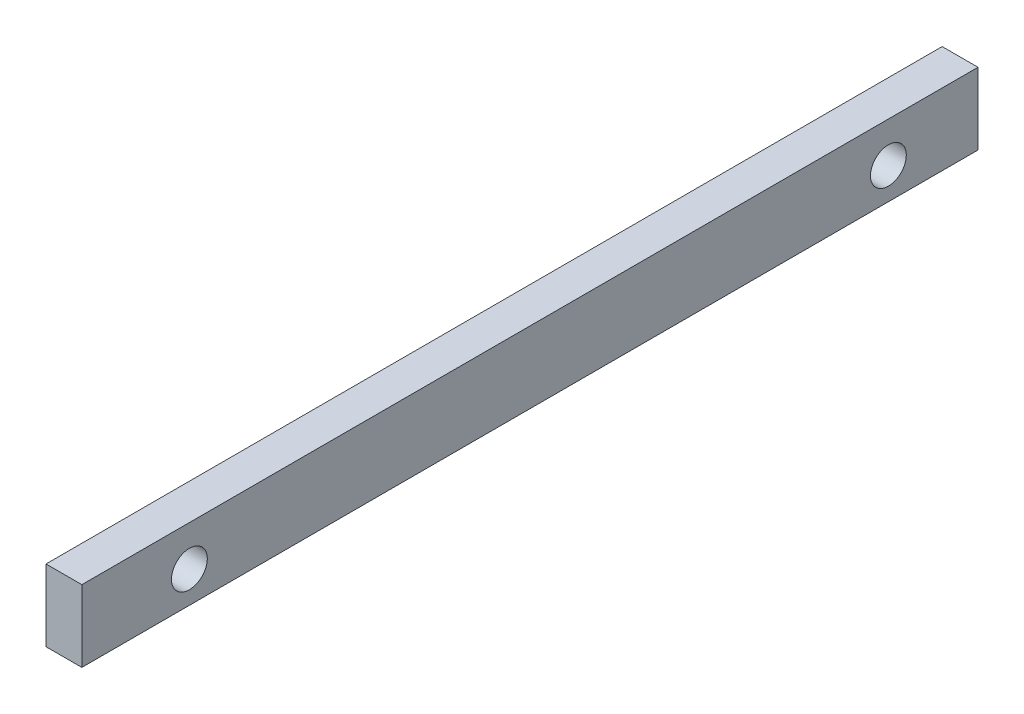
from build123d import *

# Parameters (mm, degrees)
SKETCH1_W           = 100
SKETCH1_H           = 8
SKETCH1_R           = 2
BOSS_EXTRUDE1_DEPTH = 4


with BuildPart() as part:
    # Sketch1 → Boss-Extrude1 (new body)
    with BuildSketch(Plane(origin=(0, 0, 0), x_dir=(0, 0, -1), z_dir=(1, 0, 0))):
        with Locations((9.862658316, 1.315958677)):
            Rectangle(SKETCH1_W, SKETCH1_H)
        with Locations((-28.137341684, 0.827466255)):
            Circle(SKETCH1_R, mode=Mode.SUBTRACT)
        with Locations((49.862658316, 0.827466255)):
            Circle(SKETCH1_R, mode=Mode.SUBTRACT)
    extrude(amount=BOSS_EXTRUDE1_DEPTH)


solid = part.part
